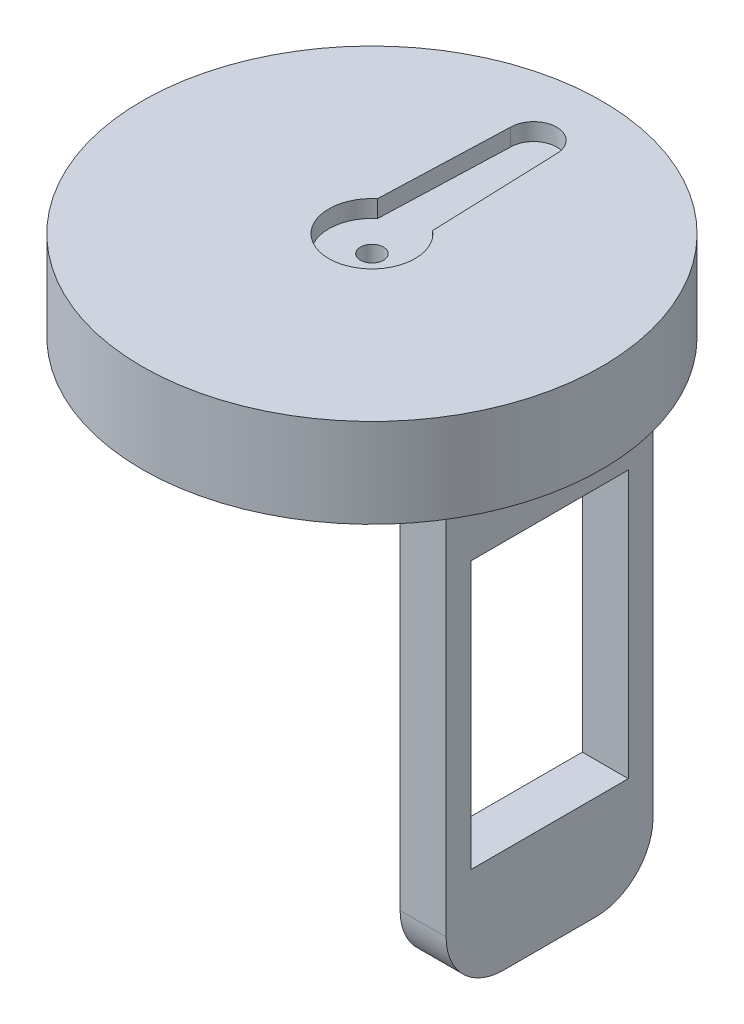
from build123d import *

# Parameters (mm, degrees)
SKETCH1_R           = 20
SKETCH1_R_2         = 18
BOSS_EXTRUDE1_DEPTH = 7.75
BOSS_EXTRUDE2_START = -4
SKETCH2_R           = 18
BOSS_EXTRUDE2_DEPTH = 4
CUT_EXTRUDE1_DEPTH  = 1.5
SKETCH4_R           = 1
CUT_EXTRUDE2_DEPTH  = 1.5
SKETCH5_W           = 18
SKETCH5_H           = 38
SKETCH5_W_2         = 13.7
SKETCH5_H_2         = 23.25
BOSS_EXTRUDE3_DEPTH = 4
SKETCH6_R           = 18
BOSS_EXTRUDE4_DEPTH = 2
SKETCH7_R           = 0.5
CUT_EXTRUDE3_DEPTH  = 3
FILLET1_R           = 5


with BuildPart() as part:
    # Sketch1 → Boss-Extrude1 (new body)
    with BuildSketch(Plane(origin=(0, 0, 0), x_dir=(1, 0, 0), z_dir=(0, 1, 0))):
        with Locations(Location((0, 0, 0), (0, 0, 270))):
            Circle(SKETCH1_R)
        with Locations(Location((0, 0, 0), (0, 0, 270))):
            Circle(SKETCH1_R_2, mode=Mode.SUBTRACT)
    extrude(amount=BOSS_EXTRUDE1_DEPTH)

    # Sketch2 → Boss-Extrude2 (add)
    with BuildSketch(Plane(origin=(0, 7.75, 0), x_dir=(1, 0, 0), z_dir=(0, 1, 0)).offset(BOSS_EXTRUDE2_START)):
        with Locations(Location((0, 0, 0), (0, 0, 270))):
            Circle(SKETCH2_R)
    extrude(amount=BOSS_EXTRUDE2_DEPTH)

    # Sketch3 → Cut-Extrude1 (cut)
    with BuildSketch(Plane(origin=(0, 7.75, 0), x_dir=(1, 0, 0), z_dir=(0, 1, 0))):
        with BuildLine():
            Line((-2.4, 2.881405907), (-2, 14.064254381))
            ThreePointArc((-2, 14.064254381), (0, 16.064254381), (2, 14.064254381))
            Line((2, 14.064254381), (2.4, 2.881405907))
            ThreePointArc((2.4, 2.881405907), (0, -3.75), (-2.4, 2.881405907))
        make_face()
    extrude(amount=-CUT_EXTRUDE1_DEPTH, mode=Mode.SUBTRACT)

    # Sketch4 → Cut-Extrude2 (cut)
    with BuildSketch(Plane(origin=(0, 6.25, 0), x_dir=(1, 0, 0), z_dir=(0, 1, 0))):
        with Locations(Location((0, 0, 0), (0, 0, 270))):
            Circle(SKETCH4_R)
    extrude(amount=-CUT_EXTRUDE2_DEPTH, mode=Mode.SUBTRACT)



with BuildPart() as body_2:
    # Sketch5 → Boss-Extrude3 (new body)
    with BuildSketch(Plane(origin=(11.45, 0, 0), x_dir=(0, 0, -1), z_dir=(1, 0, 0))):
        with Locations((0, -19)):
            Rectangle(SKETCH5_W, SKETCH5_H)
        with Locations((0, -17.375)):
            Rectangle(SKETCH5_W_2, SKETCH5_H_2, mode=Mode.SUBTRACT)
    extrude(amount=BOSS_EXTRUDE3_DEPTH)


with BuildPart() as part_1:
    add(part.part)

    add(body_2.part)  # Boss-Extrude4 merges body 2
    # Sketch6 → Boss-Extrude4 (add)
    with BuildSketch(Plane.XZ):
        with Locations(Location((0, 0, 0), (0, 0, 270))):
            Circle(SKETCH6_R)
    extrude(amount=-BOSS_EXTRUDE4_DEPTH)

    # Sketch7 → Cut-Extrude3 (cut)
    with BuildSketch(Plane.ZY.offset(-11.45)):
        with Locations((0, -30.85)):
            Circle(SKETCH7_R)
        with Locations((0, -3.25)):
            Circle(SKETCH7_R)
    extrude(amount=-CUT_EXTRUDE3_DEPTH, mode=Mode.SUBTRACT)

    # Fillet1
    fillet1_edges = [part_1.edges().sort_by_distance(p)[0] for p in [
        (13.45, -38, 9),
        (13.45, -38, -9),
    ]]
    fillet(fillet1_edges, radius=FILLET1_R)


solid = part_1.part
